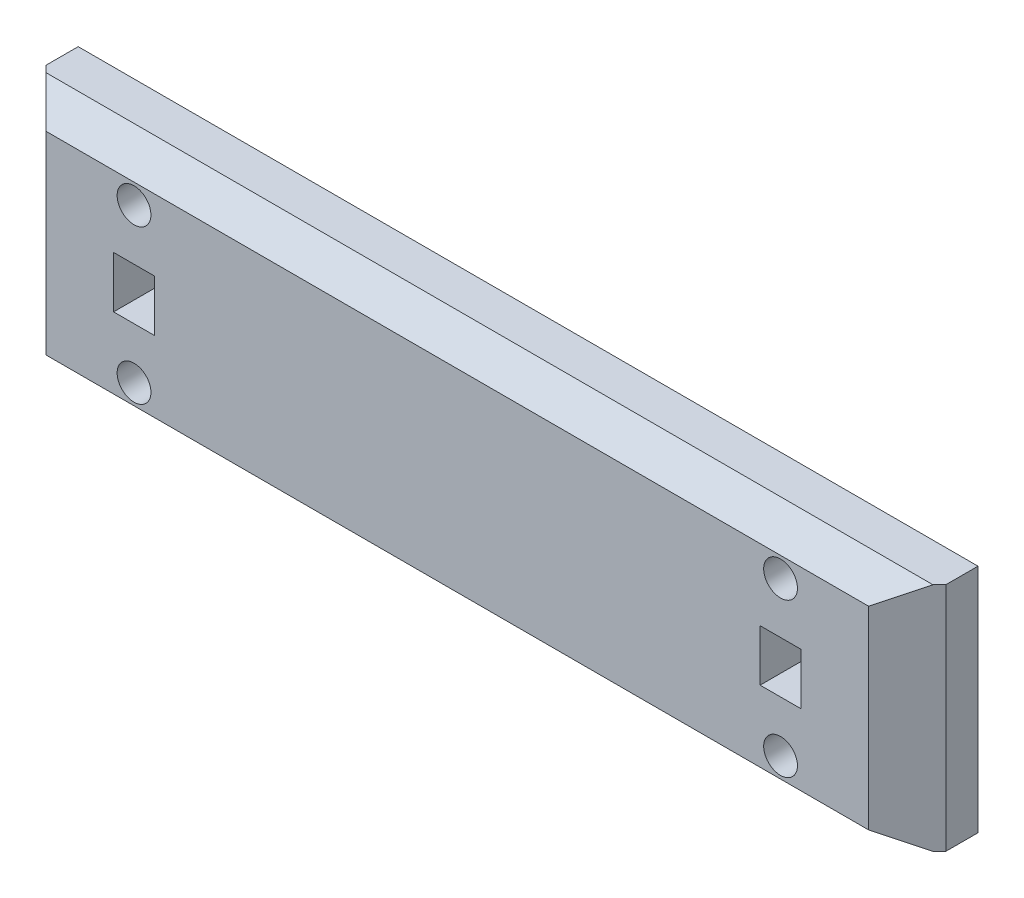
from build123d import *
from OCP.BRepFilletAPI import BRepFilletAPI_MakeChamfer

# Parameters (mm, degrees)
SKETCH1_W           = 12.7
SKETCH1_H           = 16
BOSS_EXTRUDE1_DEPTH = 22
SKETCH2_R           = 2.75
CUT_EXTRUDE1_DEPTH  = 239.308352823
SKETCH5_W           = 168.195
SKETCH5_H           = 59.75
CUT_EXTRUDE3_DEPTH  = 8
CHAMFER1_SIZE       = 10
CHAMFER1_SIZE2      = 5.773502692
SKETCH7_R           = 5.25
CUT_EXTRUDE4_DEPTH  = 10
CHAMFER2_SIZE       = 12


with BuildPart() as part:
    # Sketch1 → Boss-Extrude1 (new body)
    with BuildSketch(Plane.XY):
        Polygon((-12, 31.75), (200.195, 31.75), (233.895, 31.75), (233.895, -40), (200.895, -40), (-12.7, -40), (-45.7, -40), (-45.7, 31.75), align=None)
        with Locations((-6.35, -4.125)):
            Rectangle(SKETCH1_W, SKETCH1_H, mode=Mode.SUBTRACT)
        with Locations((194.545, -4.125)):
            Rectangle(SKETCH1_W, SKETCH1_H, mode=Mode.SUBTRACT)
    extrude(amount=BOSS_EXTRUDE1_DEPTH)

    # Sketch2 → Cut-Extrude1 (cut, through all)
    with BuildSketch(Plane.XY.offset(22)):
        with Locations((-6.35, 19.75)):
            Circle(SKETCH2_R)
        with Locations((-6.35, -28)):
            Circle(SKETCH2_R)
        with Locations((194.545, -28)):
            Circle(SKETCH2_R)
        with Locations((194.545, 19.75)):
            Circle(SKETCH2_R)
    extrude(amount=-CUT_EXTRUDE1_DEPTH, mode=Mode.SUBTRACT)

    # Sketch5 → Cut-Extrude3 (cut)
    with BuildSketch(Plane(origin=(0, 0, 0), x_dir=(-1, 0, 0), z_dir=(0, 0, -1))):
        with Locations((-94.0975, -10.125)):
            Rectangle(SKETCH5_W, SKETCH5_H)
    extrude(amount=-CUT_EXTRUDE3_DEPTH, mode=Mode.SUBTRACT)

    # Chamfer1: one chamfer whose edges measure the first distance from different faces: ONE call of the kernel's chamfer builder (chamfer() names one face for all edges)
    chamfer1_edges_1 = [part.edges().sort_by_distance(p)[0] for p in [
        (94.0975, 31.75, 22),
    ]]
    chamfer1_side_1 = [part.faces().sort_by_distance(p)[0] for p in [
        (94.0975, 31.75, 11),
    ]]
    chamfer1_edges_2 = [part.edges().sort_by_distance(p)[0] for p in [
        (94.0975, -40, 22),
    ]]
    chamfer1_side_2 = [part.faces().sort_by_distance(p)[0] for p in [
        (94.0975, -40, 12.960016897),
    ]]
    chamfer1 = BRepFilletAPI_MakeChamfer(part.part.solid().wrapped)
    for e in chamfer1_edges_1:
        chamfer1.Add(CHAMFER1_SIZE, CHAMFER1_SIZE2, e.wrapped, chamfer1_side_1[0].wrapped)  # the first distance lies on this face
    for e in chamfer1_edges_2:
        chamfer1.Add(CHAMFER1_SIZE, CHAMFER1_SIZE2, e.wrapped, chamfer1_side_2[0].wrapped)  # the first distance lies on this face
    add(Compound.cast(chamfer1.Shape()), mode=Mode.REPLACE)

    # Sketch7 → Cut-Extrude4 (cut)
    with BuildSketch(Plane.XY.offset(22)):
        with Locations((-6.35, 19.75)):
            Circle(SKETCH7_R)
        with Locations((-6.35, -28)):
            Circle(SKETCH7_R)
        with Locations((194.545, 19.75)):
            Circle(SKETCH7_R)
        with Locations((194.545, -28)):
            Circle(SKETCH7_R)
    extrude(amount=-CUT_EXTRUDE4_DEPTH, mode=Mode.SUBTRACT)

    # Chamfer2
    chamfer2_edges = [part.edges().sort_by_distance(p)[0] for p in [
        (-45.7, -4.125, 22),
        (233.895, -4.125, 22),
    ]]
    chamfer(chamfer2_edges, length=CHAMFER2_SIZE)


solid = part.part
